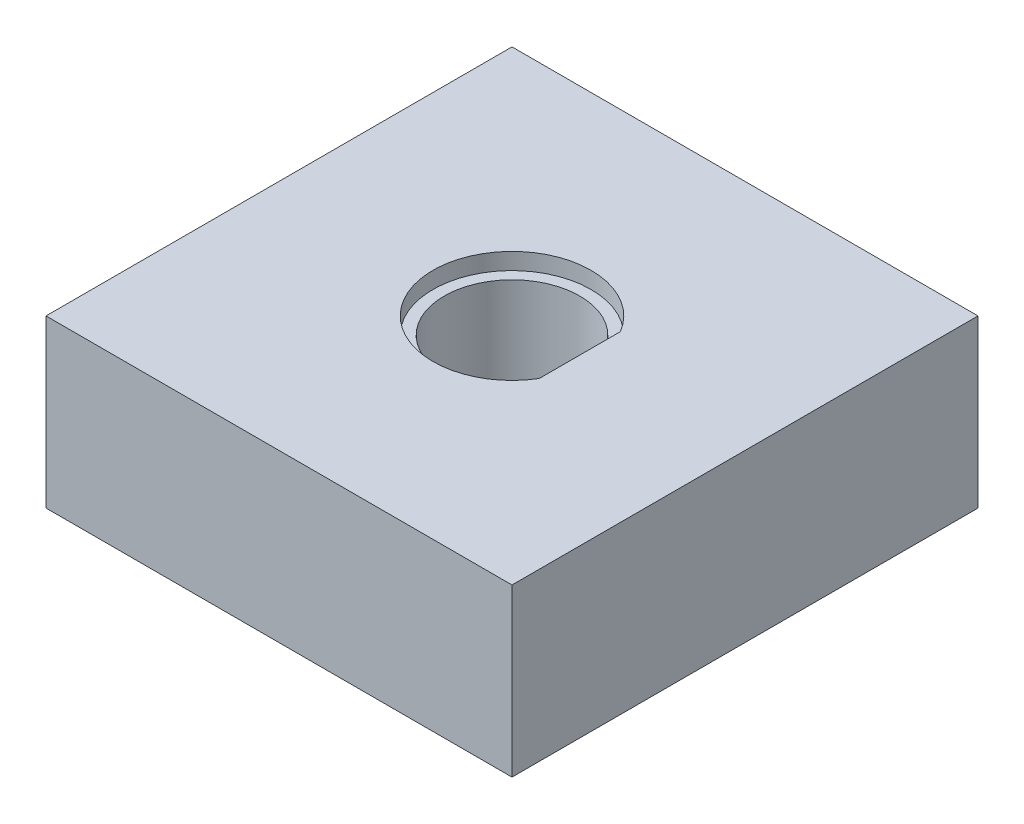
from build123d import *

# Parameters (mm, degrees)
SKETCH1_W           = 28
SKETCH1_H           = 28
BOSS_EXTRUDE1_DEPTH = 10
SKETCH2_R           = 4.075
CUT_EXTRUDE1_DEPTH  = 23.181073013
CUT_EXTRUDE2_DEPTH  = 1


with BuildPart() as part:
    # Sketch1 → Boss-Extrude1 (new body)
    with BuildSketch(Plane(origin=(0, 0, 0), x_dir=(1, 0, 0), z_dir=(0, 1, 0))):
        Rectangle(SKETCH1_W, SKETCH1_H)
    extrude(amount=BOSS_EXTRUDE1_DEPTH)

    # Sketch2 → Cut-Extrude1 (cut, through all)
    with BuildSketch(Plane(origin=(0, 10, 0), x_dir=(1, 0, 0), z_dir=(0, 1, 0))):
        with Locations(Location((0, 0, 0), (0, 0, 270))):
            Circle(SKETCH2_R)
    extrude(amount=-CUT_EXTRUDE1_DEPTH, mode=Mode.SUBTRACT)

    # Sketch3 → Cut-Extrude2 (cut)
    with BuildSketch(Plane(origin=(0, 10, 0), x_dir=(1, 0, 0), z_dir=(0, 1, 0))):
        with BuildLine():
            Line((4.075, -2.440671014), (4.075, 2.440671014))
            ThreePointArc((4.075, 2.440671014), (-4.75, 0), (4.075, -2.440671014))
        make_face()
    extrude(amount=-CUT_EXTRUDE2_DEPTH, mode=Mode.SUBTRACT)


solid = part.part
